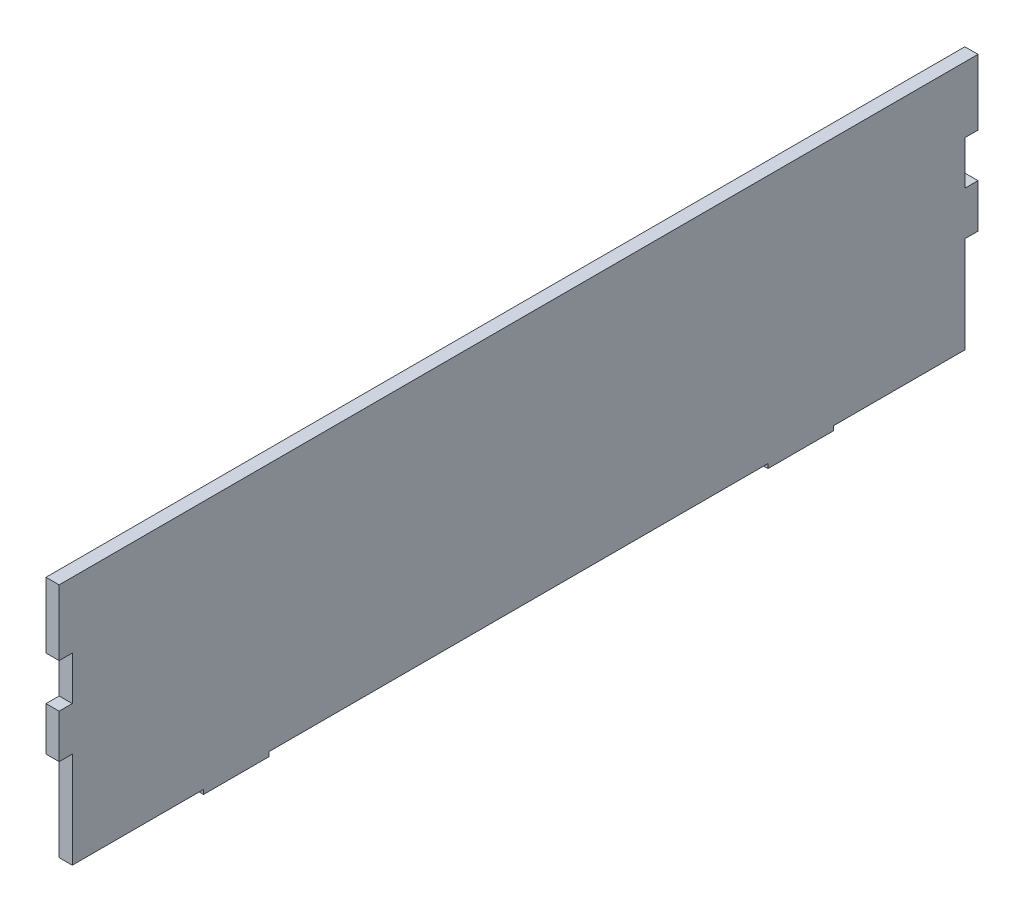
from build123d import *

# Parameters (mm, degrees)
EXTRUDE_1_DEPTH          = 0.5
EXTRUDE_2_DEPTH          = 104.5
SKETCH_8_W               = 60
SKETCH_8_H               = 8
SKETCH_8_W_2             = 60.005961803
CUT_EXTRUDE_2_DEPTH      = 10
CUT_EXTRUDE_3_DEPTH      = 10
EXTRUDE_4_DEPTH          = 2.5
FILLET_3_R               = 0.25
FILLET_4_R               = 0.25
SKETCH_7_R               = 3.5
SKETCH_7_R_2             = 0.5
CUT_EXTRUDE_4_DEPTH      = 244
SKETCH_11_W              = 182.233952392
SKETCH_11_H              = 62.441724199
CUT_EXTRUDE_5_DEPTH      = 3
SKETCH_12_W              = 153.34351729
SKETCH_12_H              = 66.332199781
CUT_EXTRUDE_6_DEPTH      = 3
CUT_EXTRUDE_7_DEPTH      = 164
CUT_EXTRUDE_7_DEPTH_BACK = 90
SKETCH_13_W              = 225.919069127
SKETCH_13_H              = 66.171542843
SKETCH_14_W              = 3
SKETCH_14_H              = 15
EXTRUDE_5_DEPTH          = 1
SKETCH_18_W              = 3
SKETCH_18_H              = 204
EXTRUDE_6_DEPTH          = 4
SKETCH_19_W              = 3
SKETCH_19_H              = 15
SKETCH_19_H_2            = 10
EXTRUDE_7_DEPTH          = 3


with BuildPart() as part:
    # 草图1 → 凸台-拉伸1 (new body)
    with BuildSketch(Plane.XY):
        Polygon((0, -1.078212291), (0, -59.078212291), (150, -59.078212291), (150, -56.078212291), (24.720670391, -21.433997855), (24.720670391, -1.078212291), align=None)
    extrude(amount=EXTRUDE_1_DEPTH)

    # 草图2 → 凸台-拉伸2 (add)
    with BuildSketch(Plane(origin=(0, 0, 0), x_dir=(-1, 0, 0), z_dir=(0, 0, -1))):
        with BuildLine():
            Line((0, -1.078212291), (-3, -1.078212291))
            Line((-3, -1.078212291), (-3, -54.078212291))
            Line((-3, -54.078212291), (-149.757649478, -58.570793397))
            ThreePointArc((-149.757649478, -58.570793397), (-149.929460817, -58.646625155), (-150, -58.820676341))
            Line((-150, -58.820676341), (-150, -58.828212291))
            ThreePointArc((-150, -58.828212291), (-149.926776695, -59.004988986), (-149.75, -59.078212291))
            Line((-149.75, -59.078212291), (0, -59.078212291))
            Line((0, -59.078212291), (0, -1.078212291))
        make_face()
    extrude(amount=EXTRUDE_2_DEPTH)

    # 镜向3: part across plane


with BuildPart() as part_1:
    add(part.part)
    add(part.part.mirror(Plane(origin=(149.75, -58.820676341, -104.5), x_dir=(1, 0, 0), z_dir=(0, 0, 1))))

    # 草图8 → 切除-拉伸2 (cut)
    with BuildSketch(Plane(origin=(-1.651096891, -53.935831773, 0), x_dir=(0.9995317742895511, -0.03059791145784333, 0), z_dir=(0.03059791145784333, 0.9995317742895511, 0))):
        with Locations((121.479673046, 5)):
            Rectangle(SKETCH_8_W, SKETCH_8_H)
        with Locations((121.476692145, 15)):
            Rectangle(SKETCH_8_W_2, SKETCH_8_H)
        with Locations((121.476692145, 24.421052632)):
            Rectangle(SKETCH_8_W_2, SKETCH_8_H)
        with Locations((121.476692145, 33.842105263)):
            Rectangle(SKETCH_8_W_2, SKETCH_8_H)
        with Locations((121.476692145, 43.263157895)):
            Rectangle(SKETCH_8_W_2, SKETCH_8_H)
        with Locations((121.476692145, 52.684210526)):
            Rectangle(SKETCH_8_W_2, SKETCH_8_H)
        with Locations((121.476692145, 62.105263158)):
            Rectangle(SKETCH_8_W_2, SKETCH_8_H)
        with Locations((121.476692145, 71.526315789)):
            Rectangle(SKETCH_8_W_2, SKETCH_8_H)
        with Locations((121.476692145, 80.947368421)):
            Rectangle(SKETCH_8_W_2, SKETCH_8_H)
        with Locations((121.476692145, 90.368421053)):
            Rectangle(SKETCH_8_W_2, SKETCH_8_H)
        with Locations((121.476692145, 99.789473684)):
            Rectangle(SKETCH_8_W_2, SKETCH_8_H)
        with Locations((121.476692145, 109.210526316)):
            Rectangle(SKETCH_8_W_2, SKETCH_8_H)
        with Locations((121.476692145, 118.631578947)):
            Rectangle(SKETCH_8_W_2, SKETCH_8_H)
        with Locations((121.476692145, 128.052631579)):
            Rectangle(SKETCH_8_W_2, SKETCH_8_H)
        with Locations((121.476692145, 137.473684211)):
            Rectangle(SKETCH_8_W_2, SKETCH_8_H)
        with Locations((121.476692145, 146.894736842)):
            Rectangle(SKETCH_8_W_2, SKETCH_8_H)
        with Locations((121.476692145, 156.315789474)):
            Rectangle(SKETCH_8_W_2, SKETCH_8_H)
        with Locations((121.476692145, 165.736842105)):
            Rectangle(SKETCH_8_W_2, SKETCH_8_H)
        with Locations((121.476692145, 175.157894737)):
            Rectangle(SKETCH_8_W_2, SKETCH_8_H)
        with Locations((121.476692145, 184.578947368)):
            Rectangle(SKETCH_8_W_2, SKETCH_8_H)
        with Locations((121.476692145, 194)):
            Rectangle(SKETCH_8_W_2, SKETCH_8_H)
        with Locations((121.479673046, 204)):
            Rectangle(SKETCH_8_W, SKETCH_8_H)
    extrude(amount=-CUT_EXTRUDE_2_DEPTH, mode=Mode.SUBTRACT)

    # 草图9 → 切除-拉伸3 (cut)
    with BuildSketch(Plane(origin=(-1.651096891, -53.935831773, 0), x_dir=(0.9995317742895511, -0.03059791145784333, 0), z_dir=(0.03059791145784333, 0.9995317742895511, 0))):
        Polygon((151.645642318, 209), (153.085665737, 209), (154.855962757, 1), (151.716207414, 1), (151.479673046, 1), (151.479673046, 209), align=None)
    extrude(amount=-CUT_EXTRUDE_3_DEPTH, mode=Mode.SUBTRACT)

    # 草图1<3> → 凸台-拉伸4 (add)
    with BuildSketch(Plane.XY):
        Polygon((0, -1.078212291), (0, -59.078212291), (150, -59.078212291), (150, -56.078212291), (24.720670391, -21.433997855), (24.720670391, -1.078212291), align=None)
    extrude_4 = extrude(amount=-EXTRUDE_4_DEPTH)

    # 圆角3
    fillet_3_edges = [part_1.edges().sort_by_distance(p)[0] for p in [
        (149.757649478, -58.570793397, -170.447368421),
        (149.757649478, -58.570793397, -179.868421053),
        (149.757649478, -58.570793397, -189.289473684),
        (149.757649478, -58.570793397, -199),
        (149.757649478, -58.570793397, -208.5),
        (149.757649478, -58.570793397, -85.657894737),
        (149.757649478, -58.570793397, -95.078947368),
        (149.757649478, -58.570793397, -104.5),
        (149.757649478, -58.570793397, -113.921052632),
        (149.757649478, -58.570793397, -123.342105263),
        (149.757649478, -58.570793397, -132.763157895),
        (149.757649478, -58.570793397, -142.184210526),
        (149.757649478, -58.570793397, -151.605263158),
        (149.757649478, -58.570793397, -161.026315789),
        (149.757649478, -58.570793397, -76.236842105),
        (149.757649478, -58.570793397, -66.815789474),
        (149.757649478, -58.570793397, -57.394736842),
        (149.757649478, -58.570793397, -47.973684211),
        (149.757649478, -58.570793397, -38.552631579),
        (149.757649478, -58.570793397, -29.131578947),
        (149.757649478, -58.570793397, -19.710526316),
        (149.757649478, -58.570793397, -10),
    ]]
    fillet(fillet_3_edges, radius=FILLET_3_R)

    # 圆角4
    fillet_4_edges = [part_1.edges().sort_by_distance(p)[0] for p in [
        (149.742116246, -59.078212291, -47.973684211),
        (149.742116246, -59.078212291, -38.552631579),
        (149.742116246, -59.078212291, -29.131578947),
        (149.742116246, -59.078212291, -19.710526316),
        (149.742116246, -59.078212291, -10),
        (149.742116246, -59.078212291, -66.815789474),
        (149.742116246, -59.078212291, -57.394736842),
        (149.742116246, -59.078212291, -85.657894737),
        (149.742116246, -59.078212291, -76.236842105),
        (149.742116246, -59.078212291, -123.342105263),
        (149.742116246, -59.078212291, -113.921052632),
        (149.742116246, -59.078212291, -104.5),
        (149.742116246, -59.078212291, -95.078947368),
        (149.742116246, -59.078212291, -132.763157895),
        (149.742116246, -59.078212291, -142.184210526),
        (149.742116246, -59.078212291, -151.605263158),
        (149.742116246, -59.078212291, -161.026315789),
        (149.742116246, -59.078212291, -208.5),
        (149.742116246, -59.078212291, -199),
        (149.742116246, -59.078212291, -189.289473684),
        (149.742116246, -59.078212291, -179.868421053),
        (149.742116246, -59.078212291, -170.447368421),
    ]]
    fillet(fillet_4_edges, radius=FILLET_4_R)

    # 镜向4: 凸台-拉伸4 across plane
    add(extrude_4.mirror(Plane(origin=(0, 0, -104.5), x_dir=(1, 0, 0), z_dir=(0, 0, -1))))

    # 草图7 → 切除-拉伸4 (cut)
    with BuildSketch(Plane.XY.offset(0.5)):
        with Locations((8, -45.078212291)):
            Circle(SKETCH_7_R)
        with Locations((25, -45.078212291)):
            Circle(SKETCH_7_R_2)
        with Locations((23, -45.078212291)):
            Circle(SKETCH_7_R_2)
    extrude(amount=-CUT_EXTRUDE_4_DEPTH, mode=Mode.SUBTRACT)

    # 草图11 → 切除-拉伸5 (cut)
    with BuildSketch(Plane.XY.offset(0.5)):
        with Locations((91.116976196, -27.857350192)):
            Rectangle(SKETCH_11_W, SKETCH_11_H)
    extrude(amount=-CUT_EXTRUDE_5_DEPTH, mode=Mode.SUBTRACT)

    # 草图12 → 切除-拉伸6 (cut)
    with BuildSketch(Plane(origin=(0, 0, -209.5), x_dir=(-1, 0, 0), z_dir=(0, 0, -1))):
        with Locations((-76.671758645, -25.912112401)):
            Rectangle(SKETCH_12_W, SKETCH_12_H)
    extrude(amount=-CUT_EXTRUDE_6_DEPTH, mode=Mode.SUBTRACT)

    # 草图13 → 切除-拉伸7 (cut, two sides: drawn at the far end of the back side and taken through both)
    with BuildSketch(Plane(origin=(3, 0, 0), x_dir=(0, 0, -1), z_dir=(1, 0, 0)).offset(-CUT_EXTRUDE_7_DEPTH_BACK)):
        with Locations((115.459534564, -87.163983712)):
            Rectangle(SKETCH_13_W, SKETCH_13_H)
    extrude(amount=CUT_EXTRUDE_7_DEPTH + CUT_EXTRUDE_7_DEPTH_BACK, mode=Mode.SUBTRACT)

    # 草图14 → 凸台-拉伸5 (add)
    with BuildSketch(Plane.XZ.offset(54.078212291)):
        with Locations((1.5, -40)):
            Rectangle(SKETCH_14_W, SKETCH_14_H)
        with Locations((1.5, -169)):
            Rectangle(SKETCH_14_W, SKETCH_14_H)
    extrude(amount=EXTRUDE_5_DEPTH)

    # 草图18 → 凸台-拉伸6 (add)
    with BuildSketch(Plane(origin=(0, -1.078212291, 0), x_dir=(1, 0, 0), z_dir=(0, 1, 0))):
        with Locations((1.5, 104.5)):
            Rectangle(SKETCH_18_W, SKETCH_18_H)
    extrude(amount=EXTRUDE_6_DEPTH)

    # 草图19 → 凸台-拉伸7 (add)
    with BuildSketch(Plane.XY.offset(-2.5)):
        with Locations((1.5, -4.578212291)):
            Rectangle(SKETCH_19_W, SKETCH_19_H)
        with Locations((1.5, -27.078212291)):
            Rectangle(SKETCH_19_W, SKETCH_19_H_2)
    extrude_7 = extrude(amount=EXTRUDE_7_DEPTH)

    # 镜向5: 凸台-拉伸7 across plane
    add(extrude_7.mirror(Plane(origin=(0, 0, -104.5), x_dir=(1, 0, 0), z_dir=(0, 0, -1))))


solid = part_1.part
